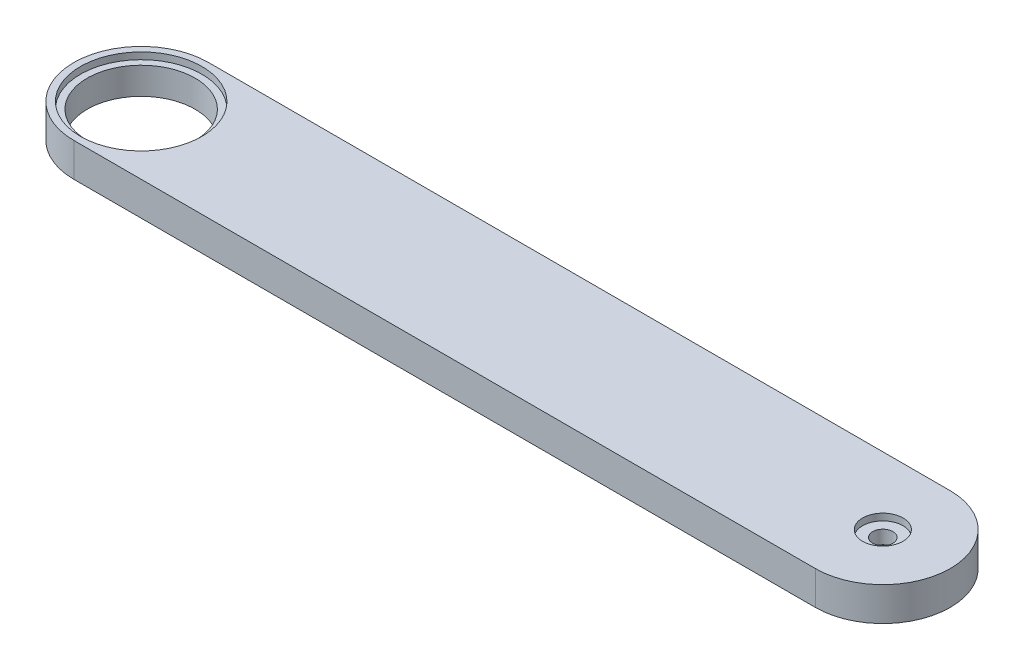
from build123d import *

# Parameters (mm, degrees)
BOSS_EXTRUDE1_DEPTH = 5
CUT_EXTRUDE1_DEPTH  = 2
CUT_EXTRUDE2_DEPTH  = 1
CUT_EXTRUDE3_DEPTH  = 71.887234394
SKETCH5_R           = 9
CUT_EXTRUDE4_DEPTH  = 1
SKETCH6_R           = 1.5
CUT_EXTRUDE5_DEPTH  = 71.823724839


with BuildPart() as part:
    # Sketch1 → Boss-Extrude1 (new body)
    with BuildSketch(Plane(origin=(0, 0, 0), x_dir=(1, 0, 0), z_dir=(0, 1, 0))):
        with BuildLine():
            Line((-50, 10), (-60, 10))
            ThreePointArc((-60, 10), (-70, 0), (-60, -10))
            Line((-60, -10), (50, -10))
            ThreePointArc((50, -10), (60, 0), (50, 10))
            Line((50, 10), (-50, 10))
        make_face()
    extrude(amount=BOSS_EXTRUDE1_DEPTH)

    # Sketch2 → Cut-Extrude1 (cut)
    with BuildSketch(Plane.XZ):
        with BuildLine():
            ThreePointArc((50, 4), (46, 0), (50, -4))
            Line((50, -4), (50, 4))
        make_face()
        with BuildLine():
            Line((50, 4), (50, -4))
            ThreePointArc((50, -4), (52.828427125, -2.828427125), (54, 0))
            ThreePointArc((54, 0), (52.828427125, 2.828427125), (50, 4))
        make_face()
    extrude(amount=-CUT_EXTRUDE1_DEPTH, mode=Mode.SUBTRACT)

    # Sketch3 → Cut-Extrude2 (cut)
    with BuildSketch(Plane(origin=(0, 5, 0), x_dir=(1, 0, 0), z_dir=(0, 1, 0))):
        with BuildLine():
            ThreePointArc((53, 0), (52.121320344, 2.121320344), (50, 3))
            Line((50, 3), (50, -3))
            ThreePointArc((50, -3), (52.121320344, -2.121320344), (53, 0))
        make_face()
        with BuildLine():
            Line((50, -3), (50, 3))
            ThreePointArc((50, 3), (47, 0), (50, -3))
        make_face()
    extrude(amount=-CUT_EXTRUDE2_DEPTH, mode=Mode.SUBTRACT)

    # Sketch4 → Cut-Extrude3 (cut, through all)
    with BuildSketch(Plane(origin=(0, 5, 0), x_dir=(1, 0, 0), z_dir=(0, 1, 0))):
        with BuildLine():
            ThreePointArc((-52, 0), (-54.343145751, 5.656854249), (-60, 8))
            Line((-60, 8), (-60, -8))
            ThreePointArc((-60, -8), (-54.343145751, -5.656854249), (-52, 0))
        make_face()
        with BuildLine():
            Line((-60, -8), (-60, 8))
            ThreePointArc((-60, 8), (-68, 0), (-60, -8))
        make_face()
    extrude(amount=-CUT_EXTRUDE3_DEPTH, mode=Mode.SUBTRACT)

    # Sketch5 → Cut-Extrude4 (cut)
    with BuildSketch(Plane(origin=(0, 5, 0), x_dir=(1, 0, 0), z_dir=(0, 1, 0))):
        with Locations(Location((-60, 0, 0), (0, 0, 270))):
            Circle(SKETCH5_R)
    extrude(amount=-CUT_EXTRUDE4_DEPTH, mode=Mode.SUBTRACT)

    # Sketch6 → Cut-Extrude5 (cut, through all)
    with BuildSketch(Plane(origin=(0, 4, 0), x_dir=(1, 0, 0), z_dir=(0, 1, 0))):
        with Locations(Location((50, 0, 0), (0, 0, 270))):
            Circle(SKETCH6_R)
    extrude(amount=-CUT_EXTRUDE5_DEPTH, mode=Mode.SUBTRACT)


solid = part.part
